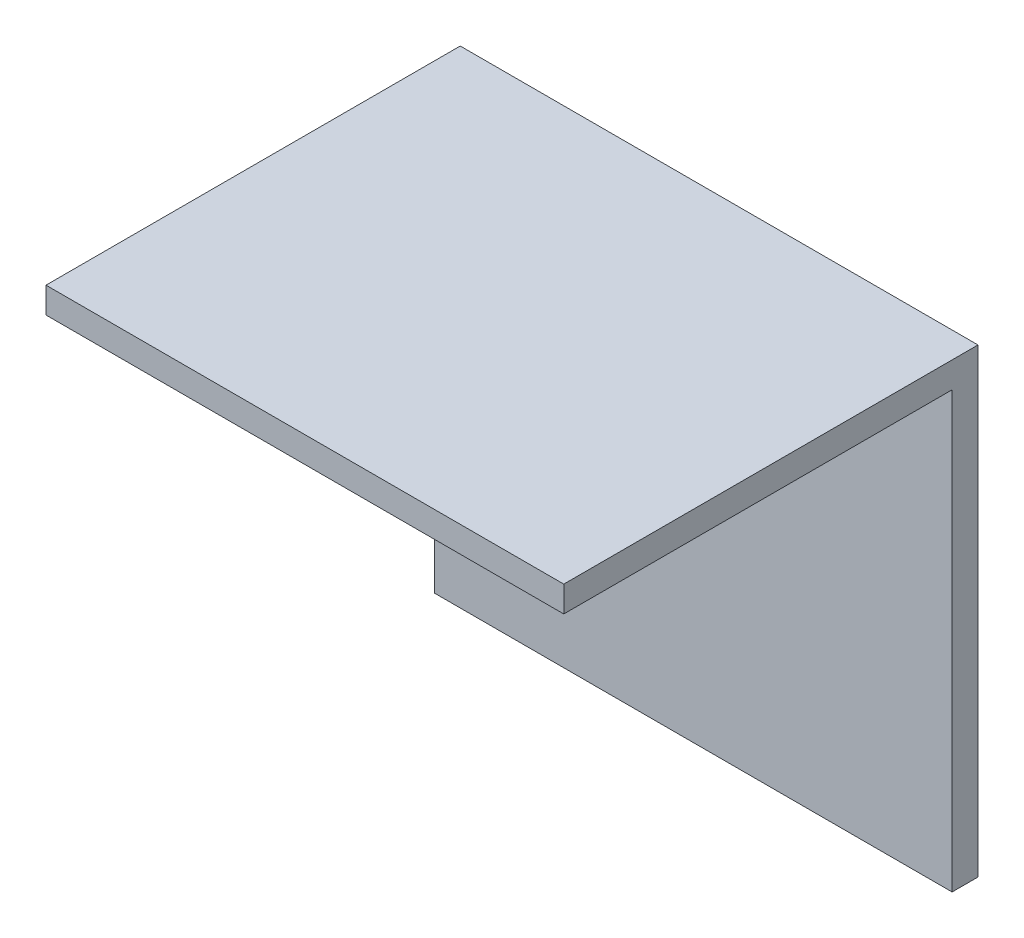
from build123d import *

# Parameters (mm, degrees)
ESBO_O1_W                  = 200
ESBO_O1_H                  = 178
RESSALTO_EXTRUS_O1_DEPTH   = 10
ESBO_O3_W                  = 200
ESBO_O3_H                  = 10
RESSALTO_EXTRUS_O2_DEPTH   = 150
CORTE_EXTRUS_O1_DEPTH      = 346.594052101
CORTE_EXTRUS_O1_DEPTH_BACK = 346.594052101
ESBO_O4_R                  = 5


with BuildPart() as part:
    # Esboço1 → Ressalto-extrusão1 (new body)
    with BuildSketch(Plane.XY):
        with Locations((-198.352557971, 0)):
            Rectangle(ESBO_O1_W, ESBO_O1_H)
    extrude(amount=RESSALTO_EXTRUS_O1_DEPTH)

    # Esboço3 → Ressalto-extrusão2 (add)
    with BuildSketch(Plane.XY.offset(10)):
        with Locations((-198.352557971, 84)):
            Rectangle(ESBO_O3_W, ESBO_O3_H)
    extrude(amount=RESSALTO_EXTRUS_O2_DEPTH)

    # Esboço4 → Corte-extrusão1 (cut, two sides: drawn at the far end of the back side and taken through both)
    with BuildSketch(Plane.XY.offset(10).offset(-CORTE_EXTRUS_O1_DEPTH_BACK)):
        with Locations((-231.685557971, -0.1112)):
            Circle(ESBO_O4_R)
    extrude(amount=CORTE_EXTRUS_O1_DEPTH + CORTE_EXTRUS_O1_DEPTH_BACK, mode=Mode.SUBTRACT)


solid = part.part
